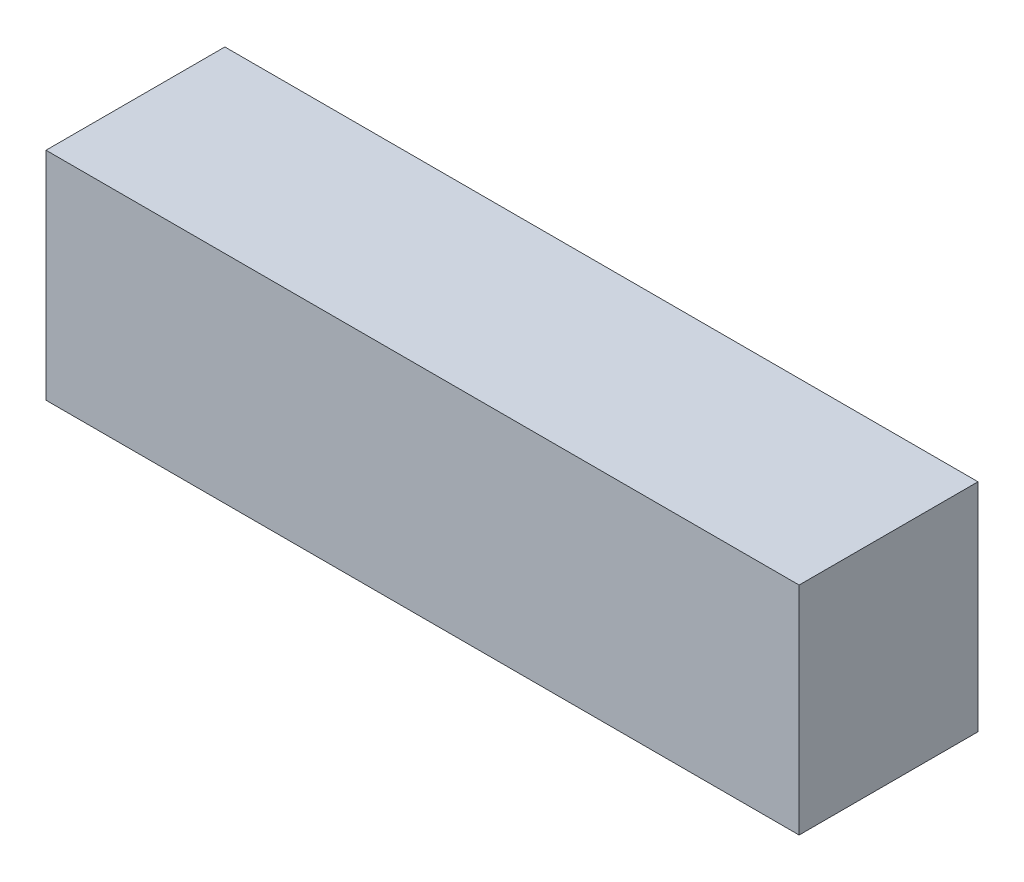
from build123d import *

# Parameters (mm, degrees)
SKETCH1_W           = 40
SKETCH1_H           = 11.5
BOSS_EXTRUDE1_DEPTH = 9.5


with BuildPart() as part:
    # Sketch1 → Boss-Extrude1 (new body)
    with BuildSketch(Plane.XY):
        with Locations((20, 5.75)):
            Rectangle(SKETCH1_W, SKETCH1_H)
    extrude(amount=BOSS_EXTRUDE1_DEPTH)


solid = part.part
